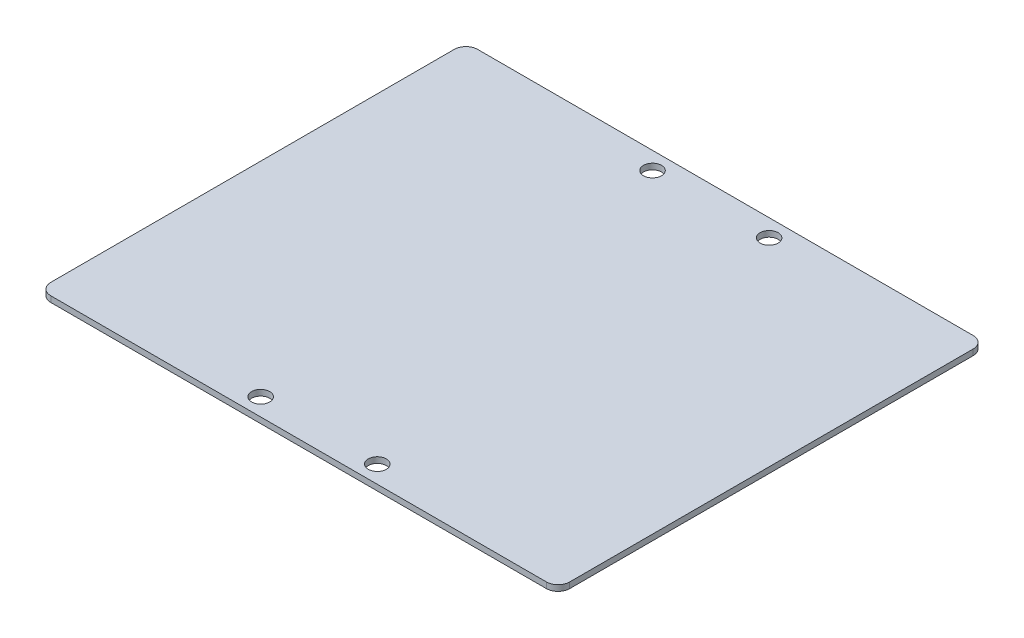
from build123d import *

# Parameters (mm, degrees)
SKETCH_1_W          = 89
SKETCH_1_H          = 73.2
EXTRUDE_1_DEPTH     = 1
SKETCH_2_R          = 1.55
CUT_EXTRUDE_1_DEPTH = 10
FILLET_1_R          = 2


with BuildPart() as part:
    # 草图1 → 凸台-拉伸1 (new body)
    with BuildSketch(Plane(origin=(0, 0, 0), x_dir=(1, 0, 0), z_dir=(0, 1, 0))):
        Rectangle(SKETCH_1_W, SKETCH_1_H)
    extrude(amount=EXTRUDE_1_DEPTH)

    # 草图2 → 切除-拉伸1 (cut)
    with BuildSketch(Plane.XZ):
        with Locations(Location((10.5, 33.6, 0), (0, 0, 270))):
            Circle(SKETCH_2_R)
        with Locations(Location((-9.5, 33.6, 0), (0, 0, 270))):
            Circle(SKETCH_2_R)
        with Locations(Location((-9.5, -33.6, 0), (0, 0, 270))):
            Circle(SKETCH_2_R)
        with Locations(Location((10.5, -33.6, 0), (0, 0, 270))):
            Circle(SKETCH_2_R)
    extrude(amount=-CUT_EXTRUDE_1_DEPTH, mode=Mode.SUBTRACT)

    # 圆角1
    fillet_1_edges = [part.edges().sort_by_distance(p)[0] for p in [
        (44.5, 0.5, 36.6),
        (-44.5, 0.5, 36.6),
        (-44.5, 0.5, -36.6),
        (44.5, 0.5, -36.6),
    ]]
    fillet(fillet_1_edges, radius=FILLET_1_R)


solid = part.part
